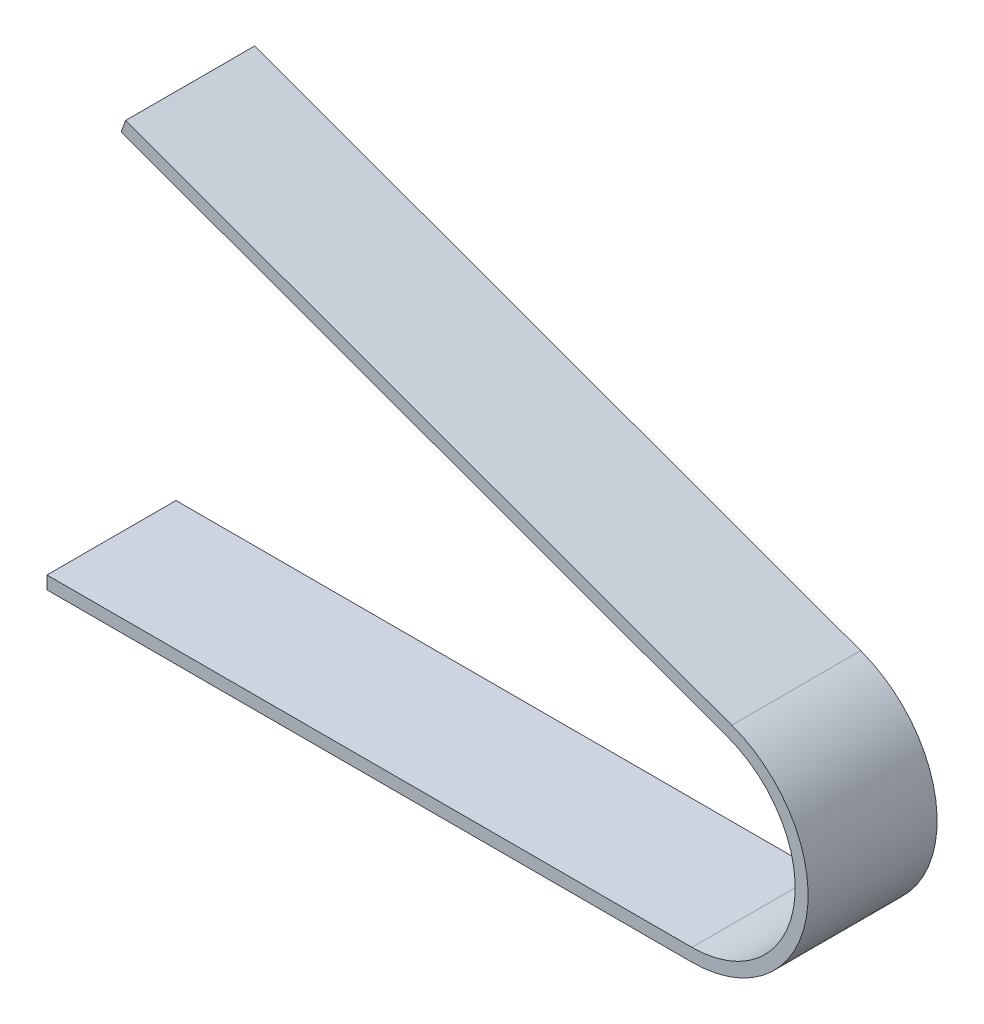
from build123d import *

# Parameters (mm, degrees)
EXTRUDE_THIN1_DEPTH = 10


with BuildPart() as part:
    # Sketch1 → Extrude-Thin1 (new body)
    with BuildSketch(Plane.XY):
        with BuildLine():
            Line((-44.248469893, 24.618548133), (2.736161147, 7.517540966))
            ThreePointArc((2.736161147, 7.517540966), (7.878462024, -1.389185421), (0, -8))
            Line((0, -8), (-50, -8))
            Line((-50, -8), (-50, -9))
            Line((-50, -9), (0, -9))
            ThreePointArc((0, -9), (8.863269777, -1.562833599), (3.07818129, 8.457233587))
            Line((3.07818129, 8.457233587), (-43.906449749, 25.558240753))
            Line((-43.906449749, 25.558240753), (-44.248469893, 24.618548133))
        make_face()
    extrude(amount=EXTRUDE_THIN1_DEPTH)


solid = part.part
